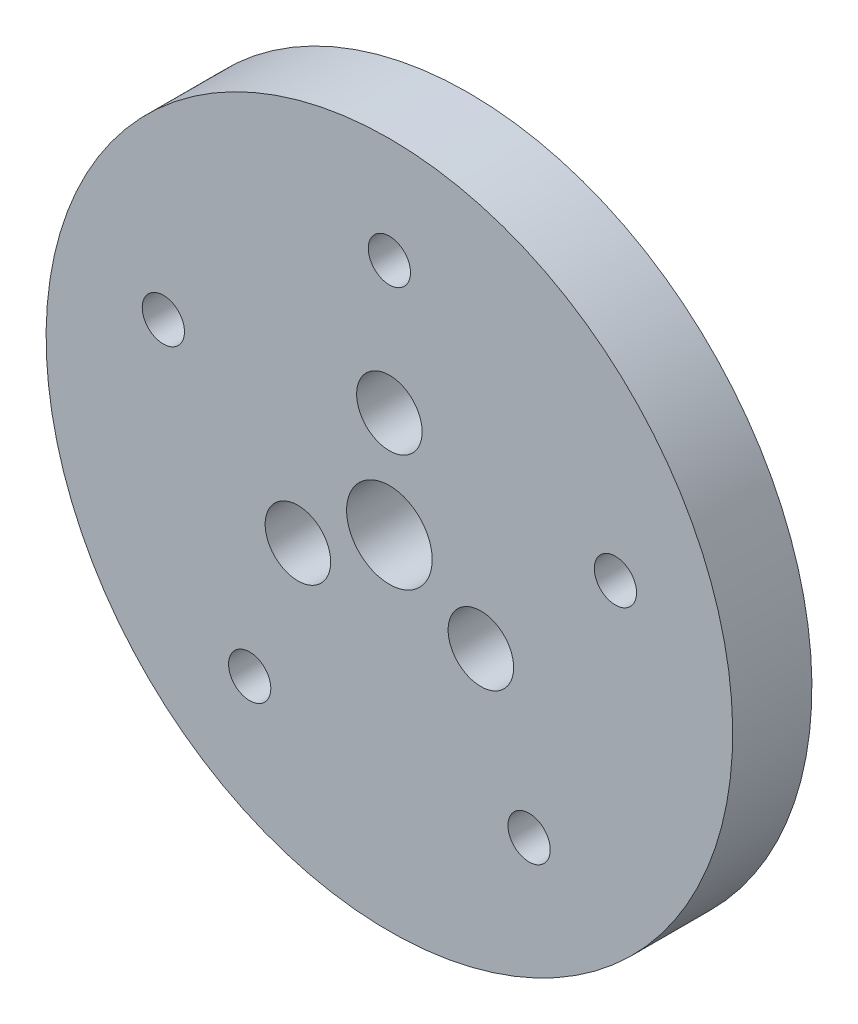
from build123d import *

# Parameters (mm, degrees)
F_4_0_4_HEAT_INSERT_M3_D         = 4
F_8_1_8_1_DURCHMESSER_BOHRUNG1_D = 8.1
SKIZZE8_R                        = 1.55
SCHNITT_LINEAR_AUSTRAGEN1_DEPTH  = 12
KREISMUSTER1_COUNT               = 5
SKIZZE9_R                        = 3.1
SCHNITT_LINEAR_AUSTRAGEN2_DEPTH  = 7.5


with BuildPart() as part:
    # Skizze1 → Rotation1 (revolve)
    with BuildSketch(Plane(origin=(0, 0, 0), x_dir=(0, 0, -1), z_dir=(1, 0, 0))):
        Polygon((0, 0), (19.5, 0), (19.5, 15), (7.5, 15), (7.5, 32.5), (0, 32.5), align=None)
    revolve(axis=Axis((0, 0, 0), (0, 0, 1)))

    # Ø4.0 (4) Heat Insert M3 (through all)
    with Locations(Plane.XY):
        with Locations((0, 22.5)):
            f_4_0_4_heat_insert_m3 = Hole(F_4_0_4_HEAT_INSERT_M3_D / 2)

    # Ø8.1 (8.1) Durchmesser Bohrung1 (through all)
    with Locations(Plane.XY):
        with Locations((0, 0)):
            Hole(F_8_1_8_1_DURCHMESSER_BOHRUNG1_D / 2)

    # Skizze8 → Schnitt-Linear austragen1 (cut)
    with BuildSketch(Plane(origin=(0, 0, -19.5), x_dir=(-1, 0, 0), z_dir=(0, 0, -1))):
        with Locations((0, 10)):
            Circle(SKIZZE8_R)
        with Locations((8.660254038, -5)):
            Circle(SKIZZE8_R)
        with Locations((-8.660254038, -5)):
            Circle(SKIZZE8_R)
    extrude(amount=-SCHNITT_LINEAR_AUSTRAGEN1_DEPTH, mode=Mode.SUBTRACT)

    # Kreismuster1: Ø4.0 (4) Heat Insert M3 ×5 about axis
    kreismuster1_axis = Axis((0, 0, 0), (0, 0, 1))
    for i in range(1, KREISMUSTER1_COUNT):
        add(f_4_0_4_heat_insert_m3.rotate(kreismuster1_axis, i * 360 / KREISMUSTER1_COUNT), mode=Mode.SUBTRACT)

    # Skizze9 → Schnitt-Linear austragen2 (cut)
    with BuildSketch(Plane.XY):
        with Locations((0, 10)):
            Circle(SKIZZE9_R)
        with Locations((8.660254038, -5)):
            Circle(SKIZZE9_R)
        with Locations((-8.660254038, -5)):
            Circle(SKIZZE9_R)
    extrude(amount=-SCHNITT_LINEAR_AUSTRAGEN2_DEPTH, mode=Mode.SUBTRACT)


solid = part.part
